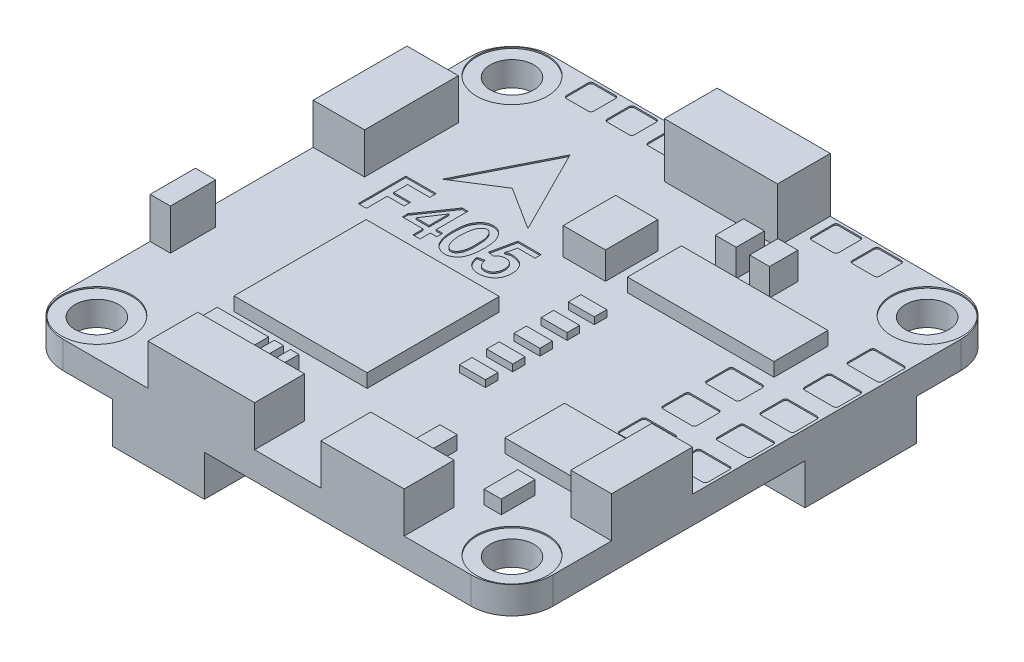
from build123d import *

# Parameters (mm, degrees)
SKETCH_1_W          = 36
SKETCH_1_H          = 36
EXTRUDE_1_DEPTH     = 2
HOLE_WIZARD_M3_1_D  = 3.2
MIRROR_2_COPY_1_D   = 3.2
FILLET_1_R          = 3
SKETCH_4_R          = 2.6
CUT_EXTRUDE_1_DEPTH = 0.1
SKETCH_5_W          = 9.776277438
SKETCH_5_H          = 9.70815007
SKETCH_5_W_2        = 10.760440912
SKETCH_5_H_2        = 3.967553588
SKETCH_5_W_3        = 5.007361615
SKETCH_5_H_3        = 4.394215294
EXTRUDE_2_DEPTH     = 1
SKETCH_6_W          = 7.839679039
SKETCH_6_H          = 3.666686085
SKETCH_6_W_2        = 6.11630132
SKETCH_6_W_3        = 3
SKETCH_6_H_2        = 5.947342719
SKETCH_6_W_4        = 3.773242667
SKETCH_6_H_3        = 6.89125001
SKETCH_6_W_5        = 1.489514466
SKETCH_6_H_4        = 3.325428784
EXTRUDE_3_DEPTH     = 3
SKETCH_7_W          = 8.311539007
SKETCH_7_H          = 3.880602794
EXTRUDE_4_DEPTH     = 4
SKETCH_8_W          = 15.717733142
SKETCH_8_H          = 14.443002208
EXTRUDE_5_DEPTH     = 2.5
SKETCH_9_W          = 4.340462534
SKETCH_9_H          = 5.858953726
SKETCH_9_W_2        = 3.829507267
SKETCH_9_H_2        = 8.175284269
SKETCH_9_W_3        = 6.744609522
SKETCH_9_H_3        = 3.301520158
EXTRUDE_6_DEPTH     = 3
SKETCH_10_W         = 8.1071569
SKETCH_10_H         = 4.561876483
EXTRUDE_7_DEPTH     = 4
CUT_EXTRUDE_START   = -0.1
SKETCH_11_R         = 2.6
CUT_EXTRUDE_2_DEPTH = 0.1
SKETCH_12_W         = 3.099795285
SKETCH_12_H         = 3.849196343
SKETCH_12_W_2       = 1.5328658
SKETCH_12_H_2       = 2.077884751
SKETCH_12_W_3       = 1.464738431
EXTRUDE_8_DEPTH     = 2
SKETCH_13_W         = 1.2671895
SKETCH_13_H         = 2.478059467
SKETCH_13_W_2       = 3.773408733
SKETCH_13_H_2       = 1.295349267
SKETCH_13_W_3       = 0.6758344
SKETCH_13_W_4       = 0.619514867
EXTRUDE_9_DEPTH     = 1
CUT_EXTRUDE_3_DEPTH = 0.1
CUT_EXTRUDE_4_DEPTH = 0.1
CUT_EXTRUDE_5_DEPTH = 0.1
SKETCH_17_W         = 1.907566329
SKETCH_17_H         = 0.919719481
EXTRUDE_10_DEPTH    = 0.5


with BuildPart() as part:
    # 草图1 → 凸台-拉伸1 (new body)
    with BuildSketch(Plane(origin=(0, 0, 0), x_dir=(1, 0, 0), z_dir=(0, 1, 0))):
        Rectangle(SKETCH_1_W, SKETCH_1_H)
    extrude(amount=EXTRUDE_1_DEPTH)

    # M3 间隙孔1 (through all)
    with Locations(Plane(origin=(0, 2, 0), x_dir=(1, 0, 0), z_dir=(0, 1, 0))):
        with Locations((-15.25, 15.25)):
            hole_wizard_m3_1 = Hole(HOLE_WIZARD_M3_1_D / 2)

    # 镜向1: M3 间隙孔1 across plane
    add(hole_wizard_m3_1.mirror(Plane.XY), mode=Mode.SUBTRACT)

    # 镜向2: M3 间隙孔1 across plane
    add(hole_wizard_m3_1.mirror(Plane(origin=(0, 0, 0), x_dir=(0, 0, 1), z_dir=(1, 0, 0))), mode=Mode.SUBTRACT)

    # 镜向2 copy 1 (through all)
    with Locations(Plane(origin=(0, 2, 0), x_dir=(-1, 0, 0), z_dir=(0, 1, 0))):
        with Locations((-15.25, 15.25)):
            Hole(MIRROR_2_COPY_1_D / 2)

    # 圆角1
    fillet_1_edges = [part.edges().sort_by_distance(p)[0] for p in [
        (-18, 1, -18),
        (18, 1, -18),
        (18, 1, 18),
        (-18, 1, 18),
    ]]
    fillet(fillet_1_edges, radius=FILLET_1_R)

    # 草图4 → 切除-拉伸1 (cut)
    with BuildSketch(Plane(origin=(0, 2, 0), x_dir=(1, 0, 0), z_dir=(0, 1, 0))):
        with Locations(Location((-15.25, 15.25, 0), (0, 0, 270))):
            Circle(SKETCH_4_R)
        with Locations(Location((15.25, 15.25, 0), (0, 0, 270))):
            Circle(SKETCH_4_R)
        with Locations(Location((-15.25, -15.25, 0), (0, 0, 270))):
            Circle(SKETCH_4_R)
        with Locations(Location((15.25, -15.25, 0), (0, 0, 270))):
            Circle(SKETCH_4_R)
    extrude(amount=-CUT_EXTRUDE_1_DEPTH, mode=Mode.SUBTRACT)

    # 草图5 → 凸台-拉伸2 (add)
    with BuildSketch(Plane(origin=(0, 2, 0), x_dir=(1, 0, 0), z_dir=(0, 1, 0))):
        with Locations((-5.569412408, -5.109552668)):
            Rectangle(SKETCH_5_W, SKETCH_5_H)
        with Locations((8.173442581, 7.673277748)):
            Rectangle(SKETCH_5_W_2, SKETCH_5_H_2)
        with Locations((11.019601921, -6.846800575)):
            Rectangle(SKETCH_5_W_3, SKETCH_5_H_3)
    extrude(amount=EXTRUDE_2_DEPTH)

    # 草图6 → 凸台-拉伸3 (add)
    with BuildSketch(Plane(origin=(0, 2, 0), x_dir=(1, 0, 0), z_dir=(0, 1, 0))):
        with Locations((-4.828813243, -16.166656958)):
            Rectangle(SKETCH_6_W, SKETCH_6_H)
        with Locations((7.015184616, -16.166656958)):
            Rectangle(SKETCH_6_W_2, SKETCH_6_H)
        with Locations((16.5, -7.710136796)):
            Rectangle(SKETCH_6_W_3, SKETCH_6_H_2)
        with Locations((-16.113378667, 6.838835564)):
            Rectangle(SKETCH_6_W_4, SKETCH_6_H_3)
        with Locations((-17.255242767, -6.923631753)):
            Rectangle(SKETCH_6_W_5, SKETCH_6_H_4)
    extrude(amount=EXTRUDE_3_DEPTH)

    # 草图7 → 凸台-拉伸4 (add)
    with BuildSketch(Plane(origin=(0, 2, 0), x_dir=(1, 0, 0), z_dir=(0, 1, 0))):
        with Locations((1.226292641, 16.059698603)):
            Rectangle(SKETCH_7_W, SKETCH_7_H)
    extrude(amount=EXTRUDE_4_DEPTH)

    # 草图8 → 凸台-拉伸5 (add)
    with BuildSketch(Plane.XZ):
        with Locations((-10.141133429, 2.299298701)):
            Rectangle(SKETCH_8_W, SKETCH_8_H)
    extrude(amount=EXTRUDE_5_DEPTH)

    # 草图9 → 凸台-拉伸6 (add)
    with BuildSketch(Plane.XZ):
        with Locations((-15.829768733, -9.146099276)):
            Rectangle(SKETCH_9_W, SKETCH_9_H)
        with Locations((16.085246367, -7.613233476)):
            Rectangle(SKETCH_9_W_2, SKETCH_9_H_2)
        with Locations((-7.970902162, 16.349239921)):
            Rectangle(SKETCH_9_W_3, SKETCH_9_H_3)
    extrude(amount=EXTRUDE_6_DEPTH)

    # 草图10 → 凸台-拉伸7 (add)
    with BuildSketch(Plane.XZ):
        with Locations((1.021910534, -15.719061759)):
            Rectangle(SKETCH_10_W, SKETCH_10_H)
    extrude(amount=EXTRUDE_7_DEPTH)

    # 草图11 → 切除-拉伸2 (cut)
    with BuildSketch(Plane.XZ.offset(CUT_EXTRUDE_START)):
        with Locations(Location((-15.25, 15.25, 0), (0, 0, 90))):
            Circle(SKETCH_11_R)
        with Locations(Location((15.25, 15.25, 0), (0, 0, 90))):
            Circle(SKETCH_11_R)
        with Locations(Location((-15.25, -15.25, 0), (0, 0, 90))):
            Circle(SKETCH_11_R)
        with Locations(Location((15.25, -15.25, 0), (0, 0, 90))):
            Circle(SKETCH_11_R)
    extrude(amount=CUT_EXTRUDE_2_DEPTH, mode=Mode.SUBTRACT)

    # 草图12 → 凸台-拉伸8 (add)
    with BuildSketch(Plane(origin=(0, 2, 0), x_dir=(1, 0, 0), z_dir=(0, 1, 0))):
        with Locations((-0.289541318, 7.528074265)):
            Rectangle(SKETCH_12_W, SKETCH_12_H)
        with Locations((5.12658451, 11.615716399)):
            Rectangle(SKETCH_12_W_2, SKETCH_12_H_2)
        with Locations((7.613233475, 11.615716399)):
            Rectangle(SKETCH_12_W_3, SKETCH_12_H_2)
    extrude(amount=EXTRUDE_8_DEPTH)

    # 草图13 → 凸台-拉伸9 (add)
    with BuildSketch(Plane(origin=(0, 2, 0), x_dir=(1, 0, 0), z_dir=(0, 1, 0))):
        with Locations((5.938241584, -11.83571088)):
            Rectangle(SKETCH_13_W, SKETCH_13_H)
        with Locations((11.654674217, -11.83571088)):
            Rectangle(SKETCH_13_W, SKETCH_13_H)
        with Locations((-8.465479065, -11.948349947)):
            Rectangle(SKETCH_13_W_2, SKETCH_13_H_2)
        with Locations((-5.818460998, -11.948349947)):
            Rectangle(SKETCH_13_W_3, SKETCH_13_H_2)
        with Locations((-4.663910565, -11.948349947)):
            Rectangle(SKETCH_13_W_4, SKETCH_13_H_2)
    extrude(amount=EXTRUDE_9_DEPTH)

    # 草图14 → 切除-拉伸3 (cut)
    with BuildSketch(Plane(origin=(0, 2, 0), x_dir=(1, 0, 0), z_dir=(0, 1, 0))):
        with BuildLine():
            Line((-11.8, 15.8), (-10.2, 15.8))
            ThreePointArc((-10.2, 15.8), (-10.058578644, 15.858578644), (-10, 16))
            Line((-10, 16), (-10, 17.6))
            ThreePointArc((-10, 17.6), (-10.058578644, 17.741421356), (-10.2, 17.8))
            Line((-10.2, 17.8), (-11.8, 17.8))
            ThreePointArc((-11.8, 17.8), (-11.941421356, 17.741421356), (-12, 17.6))
            Line((-12, 17.6), (-12, 16))
            ThreePointArc((-12, 16), (-11.941421356, 15.858578644), (-11.8, 15.8))
        make_face()
        with BuildLine():
            Line((-8.8, 15.8), (-7.2, 15.8))
            ThreePointArc((-7.2, 15.8), (-7.058578644, 15.858578644), (-7, 16))
            Line((-7, 16), (-7, 17.6))
            ThreePointArc((-7, 17.6), (-7.058578644, 17.741421356), (-7.2, 17.8))
            Line((-7.2, 17.8), (-8.8, 17.8))
            ThreePointArc((-8.8, 17.8), (-8.941421356, 17.741421356), (-9, 17.6))
            Line((-9, 17.6), (-9, 16))
            ThreePointArc((-9, 16), (-8.941421356, 15.858578644), (-8.8, 15.8))
        make_face()
        with BuildLine():
            Line((-5.8, 15.8), (-4.2, 15.8))
            ThreePointArc((-4.2, 15.8), (-4.058578644, 15.858578644), (-4, 16))
            Line((-4, 16), (-4, 17.6))
            ThreePointArc((-4, 17.6), (-4.058578644, 17.741421356), (-4.2, 17.8))
            Line((-4.2, 17.8), (-5.8, 17.8))
            ThreePointArc((-5.8, 17.8), (-5.941421356, 17.741421356), (-6, 17.6))
            Line((-6, 17.6), (-6, 16))
            ThreePointArc((-6, 16), (-5.941421356, 15.858578644), (-5.8, 15.8))
        make_face()
        with BuildLine():
            Line((6.2, 15.8), (7.8, 15.8))
            ThreePointArc((7.8, 15.8), (7.941421356, 15.858578644), (8, 16))
            Line((8, 16), (8, 17.6))
            ThreePointArc((8, 17.6), (7.941421356, 17.741421356), (7.8, 17.8))
            Line((7.8, 17.8), (6.2, 17.8))
            ThreePointArc((6.2, 17.8), (6.058578644, 17.741421356), (6, 17.6))
            Line((6, 17.6), (6, 16))
            ThreePointArc((6, 16), (6.058578644, 15.858578644), (6.2, 15.8))
        make_face()
        with BuildLine():
            Line((9.2, 15.8), (10.8, 15.8))
            ThreePointArc((10.8, 15.8), (10.941421356, 15.858578644), (11, 16))
            Line((11, 16), (11, 17.6))
            ThreePointArc((11, 17.6), (10.941421356, 17.741421356), (10.8, 17.8))
            Line((10.8, 17.8), (9.2, 17.8))
            ThreePointArc((9.2, 17.8), (9.058578644, 17.741421356), (9, 17.6))
            Line((9, 17.6), (9, 16))
            ThreePointArc((9, 16), (9.058578644, 15.858578644), (9.2, 15.8))
        make_face()
    extrude(amount=-CUT_EXTRUDE_3_DEPTH, mode=Mode.SUBTRACT)

    # 草图15 → 切除-拉伸4 (cut)
    with BuildSketch(Plane(origin=(0, 2, 0), x_dir=(1, 0, 0), z_dir=(0, 1, 0))):
        with BuildLine():
            Line((15.5, 11.2), (17.6, 11.2))
            ThreePointArc((17.6, 11.2), (17.741421356, 11.141421356), (17.8, 11))
            Line((17.8, 11), (17.8, 9.4))
            ThreePointArc((17.8, 9.4), (17.741421356, 9.258578644), (17.6, 9.2))
            Line((17.6, 9.2), (15.5, 9.2))
            ThreePointArc((15.5, 9.2), (15.358578644, 9.258578644), (15.3, 9.4))
            Line((15.3, 9.4), (15.3, 11))
            ThreePointArc((15.3, 11), (15.358578644, 11.141421356), (15.5, 11.2))
        make_face()
        with BuildLine():
            Line((11.5, 4.8), (13.6, 4.8))
            ThreePointArc((13.6, 4.8), (13.741421356, 4.741421356), (13.8, 4.6))
            Line((13.8, 4.6), (13.8, 3))
            ThreePointArc((13.8, 3), (13.741421356, 2.858578644), (13.6, 2.8))
            Line((13.6, 2.8), (11.5, 2.8))
            ThreePointArc((11.5, 2.8), (11.358578644, 2.858578644), (11.3, 3))
            Line((11.3, 3), (11.3, 4.6))
            ThreePointArc((11.3, 4.6), (11.358578644, 4.741421356), (11.5, 4.8))
        make_face()
        with BuildLine():
            Line((11.5, 1.6), (13.6, 1.6))
            ThreePointArc((13.6, 1.6), (13.741421356, 1.541421356), (13.8, 1.4))
            Line((13.8, 1.4), (13.8, -0.2))
            ThreePointArc((13.8, -0.2), (13.741421356, -0.341421356), (13.6, -0.4))
            Line((13.6, -0.4), (11.5, -0.4))
            ThreePointArc((11.5, -0.4), (11.358578644, -0.341421356), (11.3, -0.2))
            Line((11.3, -0.2), (11.3, 1.4))
            ThreePointArc((11.3, 1.4), (11.358578644, 1.541421356), (11.5, 1.6))
        make_face()
        with BuildLine():
            Line((11.5, -1.6), (13.6, -1.6))
            ThreePointArc((13.6, -1.6), (13.741421356, -1.658578644), (13.8, -1.8))
            Line((13.8, -1.8), (13.8, -3.4))
            ThreePointArc((13.8, -3.4), (13.741421356, -3.541421356), (13.6, -3.6))
            Line((13.6, -3.6), (11.5, -3.6))
            ThreePointArc((11.5, -3.6), (11.358578644, -3.541421356), (11.3, -3.4))
            Line((11.3, -3.4), (11.3, -1.8))
            ThreePointArc((11.3, -1.8), (11.358578644, -1.658578644), (11.5, -1.6))
        make_face()
        with BuildLine():
            Line((15.5, 8), (17.6, 8))
            ThreePointArc((17.6, 8), (17.741421356, 7.941421356), (17.8, 7.8))
            Line((17.8, 7.8), (17.8, 6.2))
            ThreePointArc((17.8, 6.2), (17.741421356, 6.058578644), (17.6, 6))
            Line((17.6, 6), (15.5, 6))
            ThreePointArc((15.5, 6), (15.358578644, 6.058578644), (15.3, 6.2))
            Line((15.3, 6.2), (15.3, 7.8))
            ThreePointArc((15.3, 7.8), (15.358578644, 7.941421356), (15.5, 8))
        make_face()
        with BuildLine():
            Line((15.5, 4.8), (17.6, 4.8))
            ThreePointArc((17.6, 4.8), (17.741421356, 4.741421356), (17.8, 4.6))
            Line((17.8, 4.6), (17.8, 3))
            ThreePointArc((17.8, 3), (17.741421356, 2.858578644), (17.6, 2.8))
            Line((17.6, 2.8), (15.5, 2.8))
            ThreePointArc((15.5, 2.8), (15.358578644, 2.858578644), (15.3, 3))
            Line((15.3, 3), (15.3, 4.6))
            ThreePointArc((15.3, 4.6), (15.358578644, 4.741421356), (15.5, 4.8))
        make_face()
        with BuildLine():
            Line((15.5, 1.6), (17.6, 1.6))
            ThreePointArc((17.6, 1.6), (17.741421356, 1.541421356), (17.8, 1.4))
            Line((17.8, 1.4), (17.8, -0.2))
            ThreePointArc((17.8, -0.2), (17.741421356, -0.341421356), (17.6, -0.4))
            Line((17.6, -0.4), (15.5, -0.4))
            ThreePointArc((15.5, -0.4), (15.358578644, -0.341421356), (15.3, -0.2))
            Line((15.3, -0.2), (15.3, 1.4))
            ThreePointArc((15.3, 1.4), (15.358578644, 1.541421356), (15.5, 1.6))
        make_face()
        with BuildLine():
            Line((15.5, -1.6), (17.6, -1.6))
            ThreePointArc((17.6, -1.6), (17.741421356, -1.658578644), (17.8, -1.8))
            Line((17.8, -1.8), (17.8, -3.4))
            ThreePointArc((17.8, -3.4), (17.741421356, -3.541421356), (17.6, -3.6))
            Line((17.6, -3.6), (15.5, -3.6))
            ThreePointArc((15.5, -3.6), (15.358578644, -3.541421356), (15.3, -3.4))
            Line((15.3, -3.4), (15.3, -1.8))
            ThreePointArc((15.3, -1.8), (15.358578644, -1.658578644), (15.5, -1.6))
        make_face()
    extrude(amount=-CUT_EXTRUDE_4_DEPTH, mode=Mode.SUBTRACT)

    # 草图16 → 切除-拉伸5 (cut)
    # profile 1 of 5: a face of its own
    with BuildSketch(Plane(origin=(0, 2, 0), x_dir=(1, 0, 0), z_dir=(0, 1, 0))):
        with BuildLine():
            add(Edge.make_bspline(
                [(-7.539033203, 3.441041065), (-7.537098278, 3.484632578), (-7.533324377, 3.569654018), (-7.522509067, 3.693383843), (-7.509236373, 3.810446777), (-7.492241917, 3.920537161), (-7.470985024, 4.023714789), (-7.447277992, 4.120137183), (-7.419595846, 4.209760741), (-7.377759041, 4.318996993), (-7.316507345, 4.445735512), (-7.227463167, 4.585179302), (-7.122869753, 4.710438354), (-7.024822796, 4.803931721), (-6.938694542, 4.869502618), (-6.869402853, 4.912521247), (-6.795592191, 4.948579552), (-6.717741582, 4.977750558), (-6.636205329, 5.001379638), (-6.550194191, 5.017743502), (-6.459993961, 5.027399362), (-6.366858155, 5.030184754), (-6.273114025, 5.026820819), (-6.181565792, 5.011069927), (-6.093030305, 4.987242111), (-6.007812476, 4.953246686), (-5.926178981, 4.909369505), (-5.848343678, 4.855393), (-5.773766446, 4.791855086), (-5.703043334, 4.719516583), (-5.63785848, 4.639817799), (-5.576138075, 4.556986238), (-5.523429466, 4.468156165), (-5.474695994, 4.376847099), (-5.433773945, 4.280532026), (-5.396927828, 4.180881132), (-5.369222275, 4.075985264), (-5.337567035, 3.929439596), (-5.31117046, 3.735532587), (-5.291628141, 3.49074925), (-5.286025475, 3.230159036), (-5.292926096, 3.004868161), (-5.305357031, 2.822310153), (-5.319399946, 2.689449627), (-5.33858444, 2.563010208), (-5.36018214, 2.442329079), (-5.389437513, 2.328321463), (-5.421327347, 2.219818812), (-5.458005225, 2.117632148), (-5.499478317, 2.021705703), (-5.545457577, 1.931813084), (-5.599496366, 1.84932343), (-5.659357713, 1.773658851), (-5.72523817, 1.704437425), (-5.797776125, 1.642572321), (-5.87693942, 1.587722694), (-5.962232025, 1.539574752), (-6.052318335, 1.498400473), (-6.145699073, 1.466383775), (-6.239464775, 1.443478159), (-6.332928796, 1.43146569), (-6.425876845, 1.428889101), (-6.518300796, 1.437437977), (-6.610291283, 1.455515893), (-6.701277373, 1.484461626), (-6.790664368, 1.522522859), (-6.875582617, 1.568291393), (-6.955736135, 1.616890578), (-7.02895756, 1.669517539), (-7.095032326, 1.726294607), (-7.15578597, 1.785192223), (-7.208358458, 1.849167348), (-7.255635929, 1.91566732), (-7.306448697, 2.010593728), (-7.361854558, 2.132263251), (-7.418022119, 2.282030791), (-7.465250698, 2.434586521), (-7.494371644, 2.565514336), (-7.513915085, 2.674705836), (-7.524591147, 2.764037714), (-7.533882764, 2.860194276), (-7.539495188, 2.963204901), (-7.54321706, 3.072906572), (-7.54485717, 3.189377742), (-7.543102696, 3.312855416), (-7.540416344, 3.397473253), (-7.539033203, 3.441041065)],
                knots=[0, 0, 0, 0, 1.155683737, 2.254060208, 3.289083543, 4.275996313, 5.203501349, 6.078654409, 6.905254226, 7.686259293, 9.175480835, 10.625362805, 12.057229327, 13.488373587, 14.203415217, 14.921281653, 15.645099004, 16.375632236, 17.120922195, 17.891035316, 18.691651653, 19.521200253, 20.357904477, 21.171386448, 21.975949703, 22.782724614, 23.595854961, 24.425642192, 25.286833663, 26.187407587, 27.101221321, 28.01267284, 28.920448357, 29.83426209, 30.752254981, 31.690137756, 32.645956503, 33.622989927, 35.660431351, 37.823041574, 40.125301952, 42.560703798, 43.790833543, 44.971618186, 46.098231705, 47.178004829, 48.217249088, 49.214075701, 50.172927633, 51.090920525, 51.980953586, 52.843803822, 53.698431003, 54.533503556, 55.370943622, 56.21918914, 57.080584939, 57.962199368, 58.839009869, 59.691678548, 60.51441043, 61.330511274, 62.149625556, 62.967853103, 63.80909348, 64.673955469, 65.537417366, 66.362178841, 67.155619074, 67.922554923, 68.668316995, 69.393591698, 70.113049857, 70.825595159, 72.241347001, 73.651946307, 75.059845092, 76.467821999, 77.201720101, 77.997292311, 78.850038385, 79.760306499, 80.729291287, 81.757490875, 82.845382708, 84, 84, 84, 84], degree=3))
        make_face()
        with BuildLine():
            add(Edge.make_bspline(
                [(-6.977861278, 3.555979893), (-6.982177306, 3.511180017), (-6.990655063, 3.423181891), (-6.997895633, 3.292636073), (-7.001679813, 3.165834434), (-6.997798194, 3.042820674), (-6.991975792, 2.92342021), (-6.978783691, 2.808169865), (-6.961470386, 2.6964012), (-6.94026949, 2.589209758), (-6.913829611, 2.48805887), (-6.884787158, 2.394536396), (-6.853363575, 2.308721617), (-6.818374109, 2.23152802), (-6.779801445, 2.162479141), (-6.738592347, 2.10165294), (-6.69507521, 2.048026615), (-6.647595171, 2.003940381), (-6.598752489, 1.967530717), (-6.549007836, 1.939480375), (-6.499007147, 1.919511708), (-6.448589576, 1.907903201), (-6.39754676, 1.904828899), (-6.346208778, 1.91050908), (-6.294321877, 1.923091969), (-6.243328414, 1.945533154), (-6.193564523, 1.974678612), (-6.145450085, 2.009947861), (-6.102216732, 2.053513466), (-6.061214376, 2.10260621), (-6.023731291, 2.158627264), (-5.989267497, 2.220925153), (-5.958311358, 2.290093316), (-5.921579613, 2.391863804), (-5.883710599, 2.52792928), (-5.850552956, 2.698726903), (-5.831187044, 2.87765083), (-5.825716195, 3.061632642), (-5.827672389, 3.245270282), (-5.83389152, 3.423079316), (-5.842536975, 3.592455087), (-5.855391206, 3.753511483), (-5.875731232, 3.906729084), (-5.911179652, 4.051393036), (-5.960774831, 4.186946956), (-6.013269096, 4.292233671), (-6.061129515, 4.368577067), (-6.09877721, 4.419138634), (-6.139297241, 4.461480492), (-6.180875646, 4.498035953), (-6.225428553, 4.525794618), (-6.271993088, 4.546427582), (-6.320508429, 4.560262336), (-6.37070349, 4.566100609), (-6.421340985, 4.564653932), (-6.471238926, 4.555560061), (-6.520212832, 4.538780577), (-6.567695117, 4.513408811), (-6.61446386, 4.480751764), (-6.660358559, 4.440773029), (-6.704885852, 4.392744305), (-6.748385115, 4.337168329), (-6.790229825, 4.273009942), (-6.827269186, 4.198615285), (-6.862238404, 4.115288616), (-6.891127287, 4.021551917), (-6.919915496, 3.919202218), (-6.942024009, 3.806496348), (-6.962905702, 3.684600928), (-6.972758995, 3.599860572), (-6.977861278, 3.555979893)],
                knots=[0, 0, 0, 0, 1.452167118, 2.852418281, 4.218396657, 5.543984443, 6.822765002, 8.074713207, 9.284974616, 10.471920825, 11.598846593, 12.656922723, 13.631044256, 14.5458853, 15.388812111, 16.179953707, 16.914519434, 17.61197034, 18.264888641, 18.876285569, 19.449485096, 19.996394829, 20.5387489, 21.091123116, 21.657504393, 22.254856762, 22.881287043, 23.51641241, 24.173517405, 24.856351225, 25.578003657, 26.344795291, 27.151303469, 28.020468383, 29.834110771, 31.702512638, 33.62906866, 35.634339229, 37.638355807, 39.554512999, 41.375197988, 43.110520322, 44.767505055, 46.356911141, 47.906083104, 49.416608493, 50.142950543, 50.812019548, 51.446476334, 52.031067659, 52.593805832, 53.132839029, 53.670052187, 54.215287947, 54.756919201, 55.298972215, 55.845822252, 56.420500712, 57.030186539, 57.683154838, 58.380605745, 59.14033988, 59.958423015, 60.847419337, 61.818318184, 62.871135914, 64.010020701, 65.247701822, 66.574791078, 68, 68, 68, 68], degree=3))
        make_face(mode=Mode.SUBTRACT)
    # profile 2 of 5: a face of its own
    with BuildSketch(Plane(origin=(0, 2, 0), x_dir=(1, 0, 0), z_dir=(0, 1, 0))):
        Polygon((-8.087331725, 12.350915096), (-11.232999462, 6.109982), (-8.087331725, 8.10398195), (-4.941663988, 6.109982), align=None)
    # profile 3 of 5: a face of its own
    with BuildSketch(Plane(origin=(0, 2, 0), x_dir=(1, 0, 0), z_dir=(0, 1, 0))):
        Polygon((-10.533452606, 4.495022606), (-12.165884458, 4.495022606), (-12.165884458, 3.476349071), (-10.931606716, 3.476349071), (-10.931606716, 3.001569076), (-12.165884458, 3.001569076), (-12.165884458, 1.469051368), (-12.768374263, 1.469051368), (-12.768374263, 4.969051368), (-10.533452606, 4.969051368), align=None)
    # profile 4 of 5: a face of its own
    with BuildSketch(Plane(origin=(0, 2, 0), x_dir=(1, 0, 0), z_dir=(0, 1, 0))):
        Polygon((-8.770306008, 2.245076266), (-10.302823716, 2.245076266), (-10.302823716, 2.646986547), (-8.668138161, 5.008866779), (-8.247447026, 5.008866779), (-8.247447026, 2.680040851), (-7.769662093, 2.680040851), (-7.769662093, 2.245076266), (-8.247447026, 2.245076266), (-8.247447026, 1.488583456), (-8.770306008, 1.488583456), align=None)
        Polygon((-8.770306008, 2.680040851), (-8.770306008, 4.156215995), (-9.740900556, 2.680040851), align=None, mode=Mode.SUBTRACT)
    # profile 5 of 5: a face of its own
    with BuildSketch(Plane(origin=(0, 2, 0), x_dir=(1, 0, 0), z_dir=(0, 1, 0))):
        with BuildLine():
            add(Edge.make_bspline(
                [(-4.511559496, 2.520779206), (-4.499301047, 2.47720313), (-4.475978261, 2.394295785), (-4.430879261, 2.279951356), (-4.384176757, 2.179714206), (-4.329863482, 2.096439241), (-4.273634571, 2.026604239), (-4.210759349, 1.973659683), (-4.143759211, 1.935211309), (-4.072100237, 1.915160765), (-4.00121675, 1.905921862), (-3.93271606, 1.899837354), (-3.867144367, 1.901134747), (-3.804493535, 1.905813711), (-3.744925065, 1.916879186), (-3.688965336, 1.934953651), (-3.635218297, 1.955924052), (-3.569939759, 1.993745153), (-3.495197112, 2.047542678), (-3.417670432, 2.123095698), (-3.354354295, 2.208755742), (-3.304708893, 2.303409628), (-3.268142956, 2.405690178), (-3.244269002, 2.514536655), (-3.231559953, 2.628853387), (-3.230956667, 2.746676473), (-3.242030402, 2.862816047), (-3.267556297, 2.972063166), (-3.306287785, 3.071933026), (-3.360434329, 3.159872221), (-3.423738084, 3.236560702), (-3.496185139, 3.300185114), (-3.576956692, 3.349784845), (-3.66528467, 3.384744904), (-3.759182507, 3.40690358), (-3.857714316, 3.413992357), (-3.959928417, 3.407570288), (-4.046533363, 3.391669203), (-4.11644693, 3.371330736), (-4.168134517, 3.349253902), (-4.219026704, 3.32200887), (-4.268415055, 3.288838516), (-4.316597246, 3.250339283), (-4.363464963, 3.206527862), (-4.408690672, 3.156582009), (-4.436925309, 3.120208593), (-4.451460762, 3.10148322)],
                knots=[0, 0, 0, 0, 1.537192631, 2.924645138, 4.172950761, 5.287034592, 6.295929931, 7.20786789, 8.064956688, 8.899573886, 9.716699463, 10.493344004, 11.233712164, 11.942501119, 12.62675559, 13.286166759, 13.938789652, 14.58264386, 15.843904776, 17.059411739, 18.245643967, 19.448485466, 20.678589279, 21.925530999, 23.227026748, 24.580050769, 25.922948891, 27.181997545, 28.381342405, 29.545920675, 30.675752054, 31.749220963, 32.807301153, 33.880230292, 34.963870352, 36.073362554, 37.224149094, 38.435837451, 39.057723884, 39.694624026, 40.341843349, 41.016828394, 41.713198217, 42.435647197, 43.194656643, 44, 44, 44, 44], degree=3))
            Line((-4.451460762, 3.10148322), (-4.894688923, 3.148059739))
            add(Edge.make_bspline(
                [(-4.894688923, 3.148059739), (-4.892711668, 3.157080542), (-4.887925333, 3.17891718), (-4.878705382, 3.217124611), (-4.867273219, 3.266871059), (-4.855049846, 3.328446324), (-4.839124229, 3.401287115), (-4.819949224, 3.485229034), (-4.800214536, 3.580863992), (-4.776630725, 3.687420643), (-4.750776472, 3.805496381), (-4.724598834, 3.935553627), (-4.692933911, 4.07644041), (-4.661072405, 4.229089684), (-4.626487271, 4.393155915), (-4.588928119, 4.568391378), (-4.548953224, 4.755164264), (-4.521801328, 4.883405338), (-4.507803325, 4.949519279)],
                knots=[0, 0, 0, 0, 0.24057108, 0.582349894, 1.023873684, 1.570166996, 2.217595892, 2.966196822, 3.813184297, 4.761323978, 5.809238588, 6.961962194, 8.217186954, 9.57081982, 11.02423553, 12.585169261, 14.239503842, 16, 16, 16, 16], degree=3))
            Line((-4.507803325, 4.949519279), (-2.799496822, 4.949519279))
            Line((-2.799496822, 4.949519279), (-2.799496822, 4.495022606))
            Line((-2.799496822, 4.495022606), (-4.084107253, 4.495022606))
            add(Edge.make_bspline(
                [(-4.084107253, 4.495022606), (-4.091761971, 4.454685199), (-4.106613498, 4.376423396), (-4.130028218, 4.262751754), (-4.153113539, 4.156524522), (-4.176259047, 4.057490908), (-4.200487615, 3.966502702), (-4.223517357, 3.88238069), (-4.247420951, 3.805987765), (-4.264516515, 3.757764596), (-4.27266703, 3.734773626)],
                knots=[0, 0, 0, 0, 1.256676802, 2.438178378, 3.552193711, 4.58399454, 5.550714312, 6.434047499, 7.253413474, 8, 8, 8, 8], degree=3))
            add(Edge.make_bspline(
                [(-4.27266703, 3.734773626), (-4.256324102, 3.745837936), (-4.223737314, 3.767899484), (-4.171389228, 3.795776537), (-4.116326894, 3.819099891), (-4.058577298, 3.837981686), (-3.997900152, 3.851387248), (-3.934612235, 3.860316304), (-3.868325842, 3.865005498), (-3.776362647, 3.863402296), (-3.66055846, 3.852488918), (-3.522355603, 3.827459357), (-3.387141961, 3.785921943), (-3.256084959, 3.733752957), (-3.134187161, 3.671164489), (-3.029716528, 3.595134274), (-2.941432536, 3.511089968), (-2.876463888, 3.414434391), (-2.824071755, 3.315469012), (-2.777755013, 3.217745073), (-2.740989822, 3.120087644), (-2.711185871, 3.023090535), (-2.688807494, 2.924480986), (-2.675984864, 2.822598801), (-2.668651793, 2.717209435), (-2.670855296, 2.608514149), (-2.679004348, 2.497366967), (-2.698784439, 2.384821095), (-2.725504304, 2.270744593), (-2.761146734, 2.156726492), (-2.805773656, 2.0458989), (-2.863486548, 1.942639937), (-2.932891011, 1.848252475), (-3.014099363, 1.762995012), (-3.105470858, 1.686150793), (-3.206953267, 1.617692202), (-3.317948492, 1.556559555), (-3.438640278, 1.503978805), (-3.568764682, 1.462275627), (-3.708160018, 1.435195182), (-3.856001751, 1.423799962), (-3.98375241, 1.425843174), (-4.087974592, 1.436626133), (-4.166121181, 1.450014247), (-4.243392656, 1.469442812), (-4.318742143, 1.496372223), (-4.393865376, 1.526635887), (-4.466860274, 1.564796137), (-4.538796644, 1.608665633), (-4.610632087, 1.656780897), (-4.679292569, 1.713865118), (-4.740570538, 1.783231021), (-4.797113708, 1.861794265), (-4.848500877, 1.950573411), (-4.89400579, 2.049743972), (-4.933539255, 2.159446061), (-4.968471385, 2.279036727), (-4.985698043, 2.363124095), (-4.994603068, 2.406591613)],
                knots=[0, 0, 0, 0, 0.558703968, 1.114021137, 1.676538828, 2.250740009, 2.832340435, 3.434174978, 4.059780627, 4.71234648, 6.037085189, 7.350286386, 8.683183468, 10.035824363, 11.342978111, 12.55173532, 13.685234759, 14.775295779, 15.832130109, 16.857066489, 17.835806051, 18.784875571, 19.729588613, 20.695575239, 21.690601273, 22.719138875, 23.77230156, 24.843884448, 25.951797749, 27.089129695, 28.224513774, 29.329517252, 30.430347232, 31.534120828, 32.65658214, 33.805444367, 34.995875528, 36.241061519, 37.528613975, 38.85841261, 40.253203749, 41.721664277, 42.470472116, 43.219078383, 43.965665933, 44.72382088, 45.483831453, 46.257844909, 47.053365058, 47.869794771, 48.705288143, 49.574106249, 50.483548187, 51.44336999, 52.474740496, 53.569728423, 54.743712936, 56, 56, 56, 56], degree=3))
            Line((-4.994603068, 2.406591613), (-4.511559496, 2.520779206))
        make_face()
    extrude(amount=-CUT_EXTRUDE_5_DEPTH, mode=Mode.SUBTRACT)

    # 草图17 → 凸台-拉伸10 (add)
    with BuildSketch(Plane(origin=(0, 2, 0), x_dir=(1, 0, 0), z_dir=(0, 1, 0))):
        with Locations((2.656967387, 0.895413179)):
            Rectangle(SKETCH_17_W, SKETCH_17_H)
        with Locations((2.656967387, 2.895413179)):
            Rectangle(SKETCH_17_W, SKETCH_17_H)
        with Locations((2.656967387, -1.104586822)):
            Rectangle(SKETCH_17_W, SKETCH_17_H)
        with Locations((2.656967387, -3.104586821)):
            Rectangle(SKETCH_17_W, SKETCH_17_H)
        with Locations((2.656967387, -5.104586821)):
            Rectangle(SKETCH_17_W, SKETCH_17_H)
    extrude(amount=EXTRUDE_10_DEPTH)


solid = part.part
